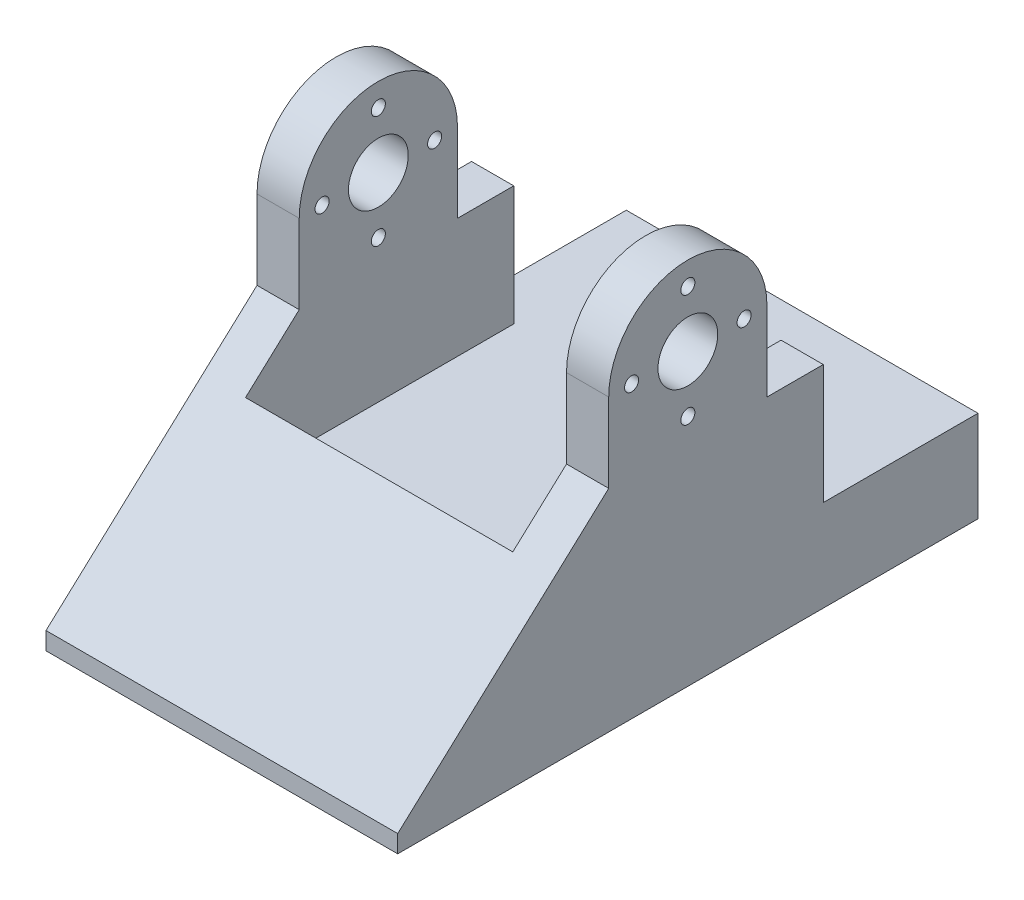
from build123d import *

# Parameters (mm, degrees)
SKETCH1_W           = 50
SKETCH1_H           = 170
BOSS_EXTRUDE1_DEPTH = 55
SKETCH2_W           = 34
SKETCH2_H           = 27
CUT_EXTRUDE1_DEPTH  = 181.416185527
SKETCH3_W           = 10
SKETCH3_H           = 24
SKETCH3_R           = 4.25
SKETCH3_R_2         = 1
CUT_EXTRUDE2_DEPTH  = 186.539753153
SKETCH4_W           = 2
SKETCH4_H           = 24
CUT_EXTRUDE3_DEPTH  = 178.623196683
SKETCH5_W           = 6.25
SKETCH5_H           = 11.25
CUT_EXTRUDE4_DEPTH  = 186.539753153
SKETCH6_W           = 38
SKETCH6_H           = 10
CUT_EXTRUDE5_DEPTH  = 181.416185527
SKETCH8_W           = 13.25
SKETCH8_H           = 2.25
CUT_EXTRUDE7_DEPTH  = 186.539753153
SKETCH9_W           = 34
SKETCH9_H           = 35.25
CUT_EXTRUDE8_DEPTH  = 179.297679458
SKETCH11_W          = 13.25
SKETCH11_H          = 20.25
CUT_EXTRUDE9_DEPTH  = 184.480414486
SKETCH12_W          = 28.5
SKETCH12_H          = 15
BOSS_EXTRUDE2_DEPTH = 8
SKETCH14_W          = 34
SKETCH14_H          = 15
SKETCH14_H_2        = 10.25
BOSS_EXTRUDE3_DEPTH = 13.25
SKETCH16_R          = 4.5
SKETCH16_R_2        = 2.5
CUT_EXTRUDE13_DEPTH = 8
SKETCH17_R          = 4.5
SKETCH17_W          = 55
SKETCH17_H          = 10.25
CUT_EXTRUDE15_DEPTH = 175.384811552
SKETCH18_W          = 71.25
SKETCH18_H          = 27.5
SKETCH18_W_2        = 13.75
SKETCH18_W_3        = 16.25
BOSS_EXTRUDE4_DEPTH = 50
SKETCH19_W          = 38
SKETCH19_H          = 7
CUT_EXTRUDE16_DEPTH = 152.25227271
SKETCH20_W          = 57.5
SKETCH20_H          = 27.5
CUT_EXTRUDE17_DEPTH = 102.137591923
CUT_EXTRUDE18_DEPTH = 100.39221549
SKETCH22_W          = 82.5
SKETCH22_H          = 2.5
BOSS_EXTRUDE5_DEPTH = 50
SKETCH24_W          = 22
SKETCH24_H          = 17
CUT_EXTRUDE19_DEPTH = 101.710289941
SKETCH25_W          = 38
SKETCH25_H          = 38.136363636
CUT_EXTRUDE20_DEPTH = 10


with BuildPart() as part:
    # Sketch1 → Boss-Extrude1 (new body)
    with BuildSketch(Plane.XY):
        with Locations((0, -85)):
            Rectangle(SKETCH1_W, SKETCH1_H)
    extrude(amount=-BOSS_EXTRUDE1_DEPTH)

    # Sketch2 → Cut-Extrude1 (cut, through all)
    with BuildSketch(Plane.XY):
        with Locations((0, -13.5)):
            Rectangle(SKETCH2_W, SKETCH2_H)
    extrude(amount=-CUT_EXTRUDE1_DEPTH, mode=Mode.SUBTRACT)

    # Sketch3 → Cut-Extrude2 (cut, through all)
    with BuildSketch(Plane(origin=(25, 0, 0), x_dir=(0, 0, -1), z_dir=(1, 0, 0))):
        with Locations((50, -12)):
            Rectangle(SKETCH3_W, SKETCH3_H)
        with Locations((5, -12)):
            Rectangle(SKETCH3_W, SKETCH3_H)
        with Locations(Location((27.5, -12.75, 0), (0, 0, 90))):
            Circle(SKETCH3_R)
        with Locations(Location((35.5, -12.75, 0), (0, 0, 90))):
            Circle(SKETCH3_R_2)
        with Locations(Location((27.5, -4.75, 0), (0, 0, 90))):
            Circle(SKETCH3_R_2)
        with Locations(Location((27.5, -20.75, 0), (0, 0, 90))):
            Circle(SKETCH3_R_2)
        with Locations(Location((19.5, -12.75, 0), (0, 0, 90))):
            Circle(SKETCH3_R_2)
    extrude(amount=-CUT_EXTRUDE2_DEPTH, mode=Mode.SUBTRACT)

    # Sketch4 → Cut-Extrude3 (cut, through all)
    with BuildSketch(Plane.XY.offset(-10)):
        with Locations((-18, -12)):
            Rectangle(SKETCH4_W, SKETCH4_H)
        with Locations((18, -12)):
            Rectangle(SKETCH4_W, SKETCH4_H)
    extrude(amount=-CUT_EXTRUDE3_DEPTH, mode=Mode.SUBTRACT)

    # Sketch5 → Cut-Extrude4 (cut, through all)
    with BuildSketch(Plane(origin=(25, 0, 0), x_dir=(0, 0, -1), z_dir=(1, 0, 0))):
        with BuildLine():
            Line((45, 0), (10, 0))
            Line((10, 0), (10, -12.75))
            Line((10, -12.75), (16.25, -12.75))
            ThreePointArc((16.25, -12.75), (27.5, -1.5), (38.75, -12.75))
            Line((38.75, -12.75), (45, -12.75))
            Line((45, -12.75), (45, 0))
        make_face()
        with Locations((13.125, -18.375)):
            Rectangle(SKETCH5_W, SKETCH5_H)
        with Locations((41.875, -18.375)):
            Rectangle(SKETCH5_W, SKETCH5_H)
    extrude(amount=-CUT_EXTRUDE4_DEPTH, mode=Mode.SUBTRACT)

    # Sketch6 → Cut-Extrude5 (cut, through all)
    with BuildSketch(Plane.XY):
        with Locations((0, -29)):
            Rectangle(SKETCH6_W, SKETCH6_H)
    extrude(amount=-CUT_EXTRUDE5_DEPTH, mode=Mode.SUBTRACT)

    # Sketch8 → Cut-Extrude7 (cut, through all)
    with BuildSketch(Plane(origin=(25, 0, 0), x_dir=(0, 0, -1), z_dir=(1, 0, 0))):
        with BuildLine():
            Line((27.5, -157.5), (27.5, -132.5))
            Line((27.5, -132.5), (13.25, -132.5))
            Line((13.25, -132.5), (13.25, -167.75))
            Line((13.25, -167.75), (17.25, -167.75))
            ThreePointArc((17.25, -167.75), (20.252155493, -160.502155493), (27.5, -157.5))
        make_face()
        with BuildLine():
            Line((41.75, -167.75), (41.75, -132.5))
            Line((41.75, -132.5), (27.5, -132.5))
            Line((27.5, -132.5), (27.5, -157.5))
            ThreePointArc((27.5, -157.5), (34.747844507, -160.502155493), (37.75, -167.75))
            Line((37.75, -167.75), (41.75, -167.75))
        make_face()
        with Locations((48.375, -168.875)):
            Rectangle(SKETCH8_W, SKETCH8_H)
        with Locations((6.625, -168.875)):
            Rectangle(SKETCH8_W, SKETCH8_H)
        with BuildLine():
            Line((17.25, -167.75), (13.25, -167.75))
            Line((13.25, -167.75), (13.25, -170))
            Line((13.25, -170), (17.5, -170))
            ThreePointArc((17.5, -170), (17.31269172, -168.881923142), (17.25, -167.75))
        make_face()
        with BuildLine():
            Line((41.75, -170), (41.75, -167.75))
            Line((41.75, -167.75), (37.75, -167.75))
            ThreePointArc((37.75, -167.75), (37.68730828, -168.881923142), (37.5, -170))
            Line((37.5, -170), (41.75, -170))
        make_face()
        with BuildLine():
            Line((27.5, -167.75), (27.5, -157.5))
            ThreePointArc((27.5, -157.5), (20.252155493, -160.502155493), (17.25, -167.75))
            Line((17.25, -167.75), (27.5, -167.75))
        make_face()
        with BuildLine():
            ThreePointArc((37.75, -167.75), (34.747844507, -160.502155493), (27.5, -157.5))
            Line((27.5, -157.5), (27.5, -167.75))
            Line((27.5, -167.75), (37.75, -167.75))
        make_face()
        with BuildLine():
            Line((27.5, -170), (27.5, -167.75))
            Line((27.5, -167.75), (17.25, -167.75))
            ThreePointArc((17.25, -167.75), (17.31269172, -168.881923142), (17.5, -170))
            Line((17.5, -170), (27.5, -170))
        make_face()
        with BuildLine():
            ThreePointArc((37.5, -170), (37.68730828, -168.881923142), (37.75, -167.75))
            Line((37.75, -167.75), (27.5, -167.75))
            Line((27.5, -167.75), (27.5, -170))
            Line((27.5, -170), (37.5, -170))
        make_face()
    extrude(amount=-CUT_EXTRUDE7_DEPTH, mode=Mode.SUBTRACT)

    # Sketch9 → Cut-Extrude8 (cut, through all)
    with BuildSketch(Plane.XY):
        with Locations((0, -150.125)):
            Rectangle(SKETCH9_W, SKETCH9_H)
    extrude(amount=-CUT_EXTRUDE8_DEPTH, mode=Mode.SUBTRACT)

    # Sketch11 → Cut-Extrude9 (cut, through all)
    with BuildSketch(Plane(origin=(25, 0, 0), x_dir=(0, 0, -1), z_dir=(1, 0, 0))):
        with BuildLine():
            ThreePointArc((17.25, -167.75), (20.252155493, -160.502155493), (27.5, -157.5))
            Line((27.5, -157.5), (27.5, -147.5))
            Line((27.5, -147.5), (13.25, -147.5))
            Line((13.25, -147.5), (13.25, -167.75))
            Line((13.25, -167.75), (17.25, -167.75))
        make_face()
        with BuildLine():
            Line((27.5, -147.5), (27.5, -157.5))
            ThreePointArc((27.5, -157.5), (34.747844507, -160.502155493), (37.75, -167.75))
            Line((37.75, -167.75), (41.75, -167.75))
            Line((41.75, -167.75), (41.75, -147.5))
            Line((41.75, -147.5), (27.5, -147.5))
        make_face()
        with Locations((48.375, -157.625)):
            Rectangle(SKETCH11_W, SKETCH11_H)
        with Locations((6.625, -157.625)):
            Rectangle(SKETCH11_W, SKETCH11_H)
    extrude(amount=-CUT_EXTRUDE9_DEPTH, mode=Mode.SUBTRACT)

    # Sketch12 → Boss-Extrude2 (add)
    with BuildSketch(Plane(origin=(25, 0, 0), x_dir=(0, 0, -1), z_dir=(1, 0, 0))):
        with Locations((27.5, -140)):
            Rectangle(SKETCH12_W, SKETCH12_H)
    boss_extrude2 = extrude(amount=-BOSS_EXTRUDE2_DEPTH)

    # Mirror1: Boss-Extrude2 across plane
    add(boss_extrude2.mirror(Plane(origin=(0, 0, 0), x_dir=(0, 0, 1), z_dir=(1, 0, 0))))

    # Sketch14 → Boss-Extrude3 (add)
    with BuildSketch(Plane.XY):
        with Locations((0, -140)):
            Rectangle(SKETCH14_W, SKETCH14_H)
        with Locations((0, -152.625)):
            Rectangle(SKETCH14_W, SKETCH14_H_2)
    boss_extrude3 = extrude(amount=-BOSS_EXTRUDE3_DEPTH)

    # Mirror2: Boss-Extrude3 across plane
    add(boss_extrude3.mirror(Plane.XY.offset(-27.5)))

    # Sketch16 → Cut-Extrude13 (cut)
    # profile 1 of 3: a face of its own
    with BuildSketch(Plane(origin=(25, 0, 0), x_dir=(0, 0, -1), z_dir=(1, 0, 0))):
        with Locations(Location((16.5, -135.75, 0), (0, 0, 90))):
            Circle(SKETCH16_R)
        with Locations((16.5, -135.75)):
            Circle(SKETCH16_R_2, mode=Mode.SUBTRACT)
    # profile 2 of 3: a face of its own
    with BuildSketch(Plane(origin=(25, 0, 0), x_dir=(0, 0, -1), z_dir=(1, 0, 0))):
        with Locations((16.5, -135.75)):
            Circle(SKETCH16_R_2)
    # profile 3 of 3: a face of its own
    with BuildSketch(Plane(origin=(25, 0, 0), x_dir=(0, 0, -1), z_dir=(1, 0, 0))):
        with Locations(Location((38.5, -135.75, 0), (0, 0, 90))):
            Circle(SKETCH16_R)
    cut_extrude13 = extrude(amount=-CUT_EXTRUDE13_DEPTH, mode=Mode.SUBTRACT)

    # Mirror3: Cut-Extrude13 across plane
    add(cut_extrude13.mirror(Plane(origin=(0, 0, 0), x_dir=(0, 0, 1), z_dir=(1, 0, 0))), mode=Mode.SUBTRACT)

    # Sketch17 → Cut-Extrude15 (cut, through all)
    # profile 1 of 4: a face of its own
    with BuildSketch(Plane(origin=(25, 0, 0), x_dir=(0, 0, -1), z_dir=(1, 0, 0))):
        Polygon((55, -51.5), (27.5, -51.5), (0, -51.5), (0, -147.5), (55, -147.5), align=None)
        with Locations((16.5, -135.75)):
            Circle(SKETCH17_R, mode=Mode.SUBTRACT)
        with Locations((38.5, -135.75)):
            Circle(SKETCH17_R, mode=Mode.SUBTRACT)
    # profile 2 of 4: a face of its own
    with BuildSketch(Plane(origin=(25, 0, 0), x_dir=(0, 0, -1), z_dir=(1, 0, 0))):
        with Locations((27.5, -152.625)):
            Rectangle(SKETCH17_W, SKETCH17_H)
    # profile 3 of 4: a face of its own
    with BuildSketch(Plane(origin=(25, 0, 0), x_dir=(0, 0, -1), z_dir=(1, 0, 0))):
        with Locations((38.5, -135.75)):
            Circle(SKETCH17_R)
    # profile 4 of 4: a face of its own
    with BuildSketch(Plane(origin=(25, 0, 0), x_dir=(0, 0, -1), z_dir=(1, 0, 0))):
        with Locations((16.5, -135.75)):
            Circle(SKETCH17_R)
    extrude(amount=-CUT_EXTRUDE15_DEPTH, mode=Mode.SUBTRACT)

    # Sketch18 → Boss-Extrude4 (add)
    with BuildSketch(Plane(origin=(25, 0, 0), x_dir=(0, 0, -1), z_dir=(1, 0, 0))):
        with Locations((-35.625, -37.75)):
            Rectangle(SKETCH18_W, SKETCH18_H)
        with Locations((61.875, -37.75)):
            Rectangle(SKETCH18_W_2, SKETCH18_H)
        Polygon((38.75, -51.5), (38.75, -24), (16.25, -24), (0, -24), (0, -51.5), align=None)
        with Locations((46.875, -37.75)):
            Rectangle(SKETCH18_W_3, SKETCH18_H)
    extrude(amount=-BOSS_EXTRUDE4_DEPTH)

    # Sketch19 → Cut-Extrude16 (cut, through all)
    with BuildSketch(Plane.XY.offset(71.25)):
        with Locations((0, -27.5)):
            Rectangle(SKETCH19_W, SKETCH19_H)
    extrude(amount=-CUT_EXTRUDE16_DEPTH, mode=Mode.SUBTRACT)

    # Sketch20 → Cut-Extrude17 (cut, through all)
    with BuildSketch(Plane(origin=(25, 0, 0), x_dir=(0, 0, -1), z_dir=(1, 0, 0))):
        with Locations((-42.5, -37.75)):
            Rectangle(SKETCH20_W, SKETCH20_H)
    extrude(amount=-CUT_EXTRUDE17_DEPTH, mode=Mode.SUBTRACT)

    # Sketch21 → Cut-Extrude18 (cut, through all)
    with BuildSketch(Plane(origin=(25, 0, 0), x_dir=(0, 0, -1), z_dir=(1, 0, 0))):
        Polygon((16.25, -24), (-13.75, -51.5), (-13.75, -24), align=None)
    extrude(amount=-CUT_EXTRUDE18_DEPTH, mode=Mode.SUBTRACT)

    # Sketch22 → Boss-Extrude5 (add)
    with BuildSketch(Plane(origin=(25, 0, 0), x_dir=(0, 0, -1), z_dir=(1, 0, 0))):
        with Locations((27.5, -52.75)):
            Rectangle(SKETCH22_W, SKETCH22_H)
    extrude(amount=-BOSS_EXTRUDE5_DEPTH)

    # Sketch24 → Cut-Extrude19 (cut, through all)
    with BuildSketch(Plane(origin=(25, 0, 0), x_dir=(0, 0, -1), z_dir=(1, 0, 0))):
        with Locations((57.75, -32.5)):
            Rectangle(SKETCH24_W, SKETCH24_H)
    extrude(amount=-CUT_EXTRUDE19_DEPTH, mode=Mode.SUBTRACT)

    # Sketch25 → Cut-Extrude20 (cut)
    with BuildSketch(Plane(origin=(0, -31, 0), x_dir=(1, 0, 0), z_dir=(0, 1, 0))):
        with Locations((0, 27.681818182)):
            Rectangle(SKETCH25_W, SKETCH25_H)
    extrude(amount=-CUT_EXTRUDE20_DEPTH, mode=Mode.SUBTRACT)


solid = part.part
